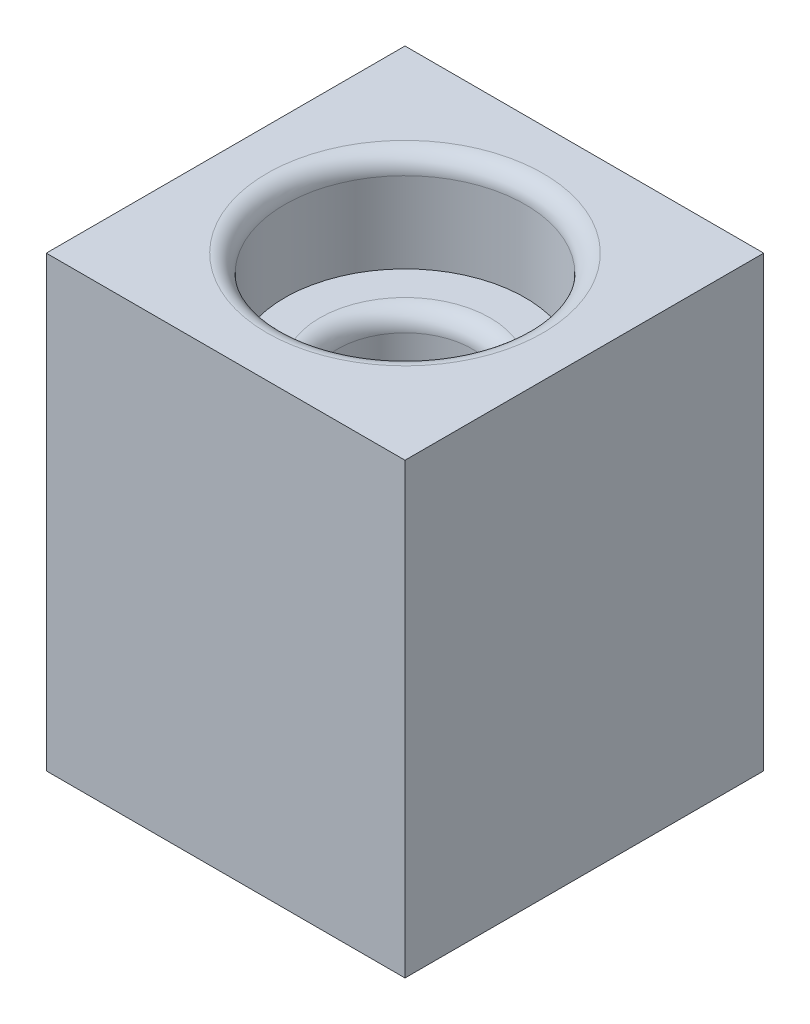
from build123d import *

# Parameters (mm, degrees)
SKETCH3_W           = 20
SKETCH3_H           = 20
BOSS_EXTRUDE1_DEPTH = 25
SKETCH4_R           = 3.75
CUT_EXTRUDE1_DEPTH  = 29.722813233
SKETCH4_3_R         = 6.7
CUT_EXTRUDE2_DEPTH  = 5.5
CUT_EXTRUDE3_START  = -19.5
SKETCH4_4_R         = 6.7
CUT_EXTRUDE3_DEPTH  = 5.5
FILLET1_R           = 1
FILLET2_R           = 1


with BuildPart() as part:
    # Sketch3 → Boss-Extrude1 (new body)
    with BuildSketch(Plane(origin=(0, 0, 0), x_dir=(1, 0, 0), z_dir=(0, 1, 0))):
        Rectangle(SKETCH3_W, SKETCH3_H)
    extrude(amount=BOSS_EXTRUDE1_DEPTH)

    # Sketch4 → Cut-Extrude1 (cut, through all)
    with BuildSketch(Plane(origin=(0, 25, 0), x_dir=(1, 0, 0), z_dir=(0, 1, 0))):
        with Locations(Location((0, 0, 0), (0, 0, 270))):
            Circle(SKETCH4_R)
    extrude(amount=-CUT_EXTRUDE1_DEPTH, mode=Mode.SUBTRACT)

    # Sketch4<3> → Cut-Extrude2 (cut)
    with BuildSketch(Plane(origin=(0, 25, 0), x_dir=(1, 0, 0), z_dir=(0, 1, 0))):
        with Locations(Location((0, 0, 0), (0, 0, 270))):
            Circle(SKETCH4_3_R)
    extrude(amount=-CUT_EXTRUDE2_DEPTH, mode=Mode.SUBTRACT)

    # Sketch4<4> → Cut-Extrude3 (cut)
    with BuildSketch(Plane(origin=(0, 25, 0), x_dir=(1, 0, 0), z_dir=(0, 1, 0)).offset(CUT_EXTRUDE3_START)):
        with Locations(Location((0, 0, 0), (0, 0, 270))):
            Circle(SKETCH4_4_R)
    extrude(amount=-CUT_EXTRUDE3_DEPTH, mode=Mode.SUBTRACT)

    # Fillet1
    fillet1_edges = [part.edges().sort_by_distance(p)[0] for p in [
        (0, 25, -6.7),
        (0, 0, -6.7),
    ]]
    fillet(fillet1_edges, radius=FILLET1_R)

    # Fillet2
    fillet2_edges = [part.edges().sort_by_distance(p)[0] for p in [
        (0, 19.5, -3.75),
        (0, 5.5, -3.75),
    ]]
    fillet(fillet2_edges, radius=FILLET2_R)


solid = part.part
